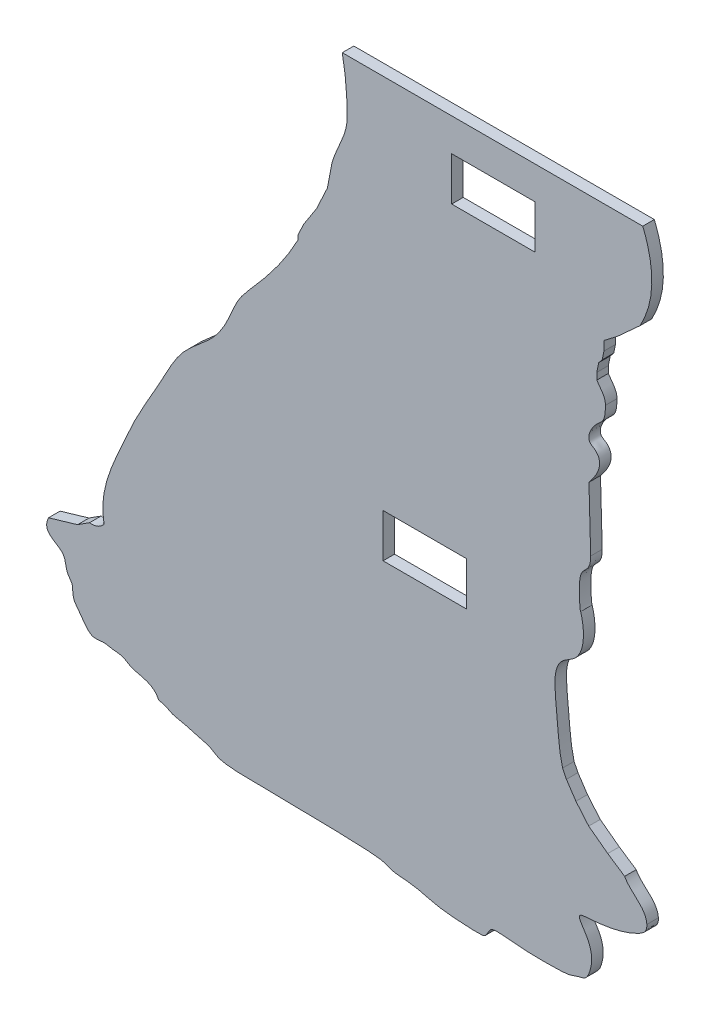
from build123d import *

# Parameters (mm, degrees)
SKETCH1_W           = 23
SKETCH1_H           = 12
BOSS_EXTRUDE2_DEPTH = 3.175


with BuildPart() as part:
    # Sketch1 → Boss-Extrude2 (new body)
    with BuildSketch(Plane.XY):
        with BuildLine():
            Line((167.202192931, 42.201207676), (162.551708352, 45.309526764))
            Line((162.551708352, 45.309526764), (157.314695785, 49.223337881))
            Line((157.314695785, 49.223337881), (153.792941224, 53.393644073))
            Line((153.792941224, 53.393644073), (151.178747268, 57.312700692))
            Line((151.178747268, 57.312700692), (150.112611404, 59.463302564))
            add(Edge.make_bspline(
                [(150.112611404, 59.463302564), (148.956776361, 63.836980097), (148.948583694, 71.439405876), (146.850507307, 84.051422667), (156.469353715, 88.150203705), (156.247504434, 95.51023866), (155.085269681, 99.2555556)],
                knots=[0, 0, 0, 0, 0.30878338, 0.618237109, 0.70440559, 1, 1, 1, 1], degree=3))
            add(Edge.make_bspline(
                [(157.85398611, 113.880538491), (157.856396998, 113.869859914), (157.850620297, 110.688002063), (155.308060719, 109.384630599), (154.418838948, 105.053269567), (154.8695522, 99.483416676), (155.085269681, 99.2555556)],
                knots=[0, 0, 0, 0, 0.124798805, 0.365607846, 0.555267038, 1, 1, 1, 1], degree=3))
            Line((157.85398611, 113.880538491), (157.37548461, 131.229540091))
            add(Edge.make_bspline(
                [(161.892659898, 151.807216677), (161.91251897, 149.031337188), (161.449944322, 147.791607901), (158.445100345, 145.385958906), (156.130886371, 141.380315264), (158.830222147, 140.043511959), (161.648730322, 137.407909117), (159.459654716, 133.727674066), (157.37548461, 131.229540091)],
                knots=[0, 0, 0, 0, 0.190659477, 0.228612673, 0.488802546, 0.534056192, 0.585175937, 1, 1, 1, 1], degree=3))
            add(Edge.make_bspline(
                [(159.534362736, 156.659486678), (160.786697559, 154.839870961), (162.005548182, 153.612430632), (161.892659898, 151.807216677)],
                knots=[0, 0, 0, 0, 1, 1, 1, 1], degree=3))
            Line((159.534362736, 156.659486678), (159.534362736, 158.498026385))
            Line((159.534362736, 158.498026385), (160.082455849, 161.112276627))
            Line((160.082455849, 161.112276627), (161.024283069, 162.24246929))
            Line((161.024283069, 162.24246929), (161.51276424, 164.572387305))
            Line((161.51276424, 164.572387305), (161.51276424, 167.102297744))
            Line((161.51276424, 167.102297744), (165.183542032, 169.901250177))
            Line((165.183542032, 169.901250177), (171.472031107, 175.621746691))
            add(Edge.make_bspline(
                [(172.196352762, 199.687728108), (177.512545782, 186.611864968), (171.472031107, 175.621746691)],
                knots=[0, 0, 0, 1, 1, 1], degree=2))
            Line((172.196352762, 199.687728108), (89.47301913, 199.687728108))
            add(Edge.make_bspline(
                [(89.47301913, 199.687728108), (90.449698127, 194.83749072), (90.825955315, 189.837761557), (90.838257386, 180.280743918), (87.678298822, 176.191377166), (86.590775441, 171.767770411)],
                knots=[0, 0, 0, 0, 0.517811069, 0.520823107, 1, 1, 1, 1], degree=3))
            Line((86.590775441, 171.767770411), (85.388246292, 165.381063893))
            Line((85.388246292, 165.381063893), (82.402306125, 158.982620678))
            Line((82.402306125, 158.982620678), (78.826589302, 153.432528352))
            Line((78.826589302, 153.432528352), (77.30963174, 150.181905003))
            Line((77.30963174, 150.181905003), (77.30963174, 148.972997238))
            add(Edge.make_bspline(
                [(23.904060298, 54.499744977), (22.54196001, 62.044422938), (27.151157223, 71.719882884), (33.171565612, 85.673583344), (39.470341202, 95.744406946), (45.044436084, 107.397118431), (54.154773918, 113.07293548), (58.357878564, 120.674742163), (60.641830631, 126.791490456), (68.416588167, 135.274765788), (73.920776574, 142.489426767), (77.30963174, 148.972997238)],
                knots=[0, 0, 0, 0, 0.194457475, 0.285904466, 0.412663627, 0.517827397, 0.629268786, 0.691338637, 0.750377013, 0.804905464, 1, 1, 1, 1], degree=3))
            add(Edge.make_bspline(
                [(19.90471503, 52.852955749), (22.437142387, 52.608313662), (23.904060298, 54.499744977)],
                knots=[0, 0, 0, 1, 1, 1], degree=2))
            Line((19.90471503, 52.852955749), (16.611136574, 50.735655313))
            Line((16.611136574, 50.735655313), (8.612446038, 48.383099273))
            add(Edge.make_bspline(
                [(8.612446038, 48.383099273), (6.569110394, 43.962826835), (13.647787757, 43.729648821), (13.25353988, 37.991488936), (15.22587651, 36.112808324), (15.244510931, 34.207409749), (15.425694449, 32.409220236), (16.98119857, 30.317149701), (18.454955258, 28.208570124), (20.727276999, 25.608877763), (23.640354073, 26.519579017), (26.378802415, 25.704997487), (29.007712932, 25.794951803), (31.225977748, 24.007852384), (34.946801718, 23.349304233), (38.00066538, 22.222153794), (38.883062856, 20.144990847)],
                knots=[0, 0, 0, 0, 0.185719976, 0.273851295, 0.320038418, 0.350192261, 0.393849297, 0.435550567, 0.514834292, 0.569194905, 0.638873602, 0.687586559, 0.755837415, 0.80106818, 0.86555143, 1, 1, 1, 1], degree=3))
            add(Edge.make_bspline(
                [(38.883062856, 20.144990847), (41.287485761, 19.565633761), (42.345781106, 18.507338416), (45.419877108, 18.154573301), (49.753848521, 16.793907858), (52.777549507, 16.18916766), (54.793350164, 14.828502217), (56.355595674, 14.173367003), (60.135221906, 13.770206872), (61.546282366, 13.770206872), (99.241754657, 13.215861691), (101.285601848, 12.223202762), (103.959367113, 11.297668631), (106.324621001, 11.297668631), (111.569314404, 10.577808752), (115.168613799, 9.24092612), (123.909769472, 8.521066241), (128.023254495, 8.521066241), (128.948788625, 8.726740492), (129.97715988, 10.783483004), (131.005531136, 11.811854259), (139.335338307, 10.783483004), (144.785705962, 10.783483004), (151.984304751, 10.783483004), (154.349558639, 12.120365636), (156.714812527, 12.120365636), (158.154532285, 16.028176407), (158.154532285, 19.318964425), (157.331835281, 21.684218313), (156.40630115, 23.329612322), (153.732535886, 27.134585968), (157.318908473, 27.134585968), (163.062883757, 27.775503981), (167.439245879, 28.924299038), (170.393290311, 30.100446358), (172.444710055, 31.285711099), (173.20373536, 32.322817748), (173.319982479, 33.191252106), (173.319982479, 33.793001898)],
                knots=[0, 0, 0, 0, 0.028571429, 0.057142857, 0.085714286, 0.114285714, 0.142857143, 0.171428571, 0.2, 0.228571429, 0.257142857, 0.285714286, 0.314285714, 0.342857143, 0.371428571, 0.4, 0.428571429, 0.457142857, 0.485714286, 0.514285714, 0.542857143, 0.571428571, 0.6, 0.628571429, 0.657142857, 0.685714286, 0.714285714, 0.742857143, 0.771428571, 0.8, 0.828571429, 0.857142857, 0.885714286, 0.914285714, 0.942857143, 0.971428571, 0.985714286, 1, 1, 1, 1], degree=3))
            add(Edge.make_bspline(
                [(173.319982479, 33.793001898), (173.056351571, 37.626592871), (168.840626644, 39.112234918), (167.202192931, 42.201207676)],
                knots=[0, 0, 0, 0, 1, 1, 1, 1], degree=3))
        make_face()
        with Locations((112.203138272, 90.163085625)):
            Rectangle(SKETCH1_W, SKETCH1_H, mode=Mode.SUBTRACT)
        with Locations((131.091721685, 184.658299227)):
            Rectangle(SKETCH1_W, SKETCH1_H, mode=Mode.SUBTRACT)
    extrude(amount=BOSS_EXTRUDE2_DEPTH)


solid = part.part
